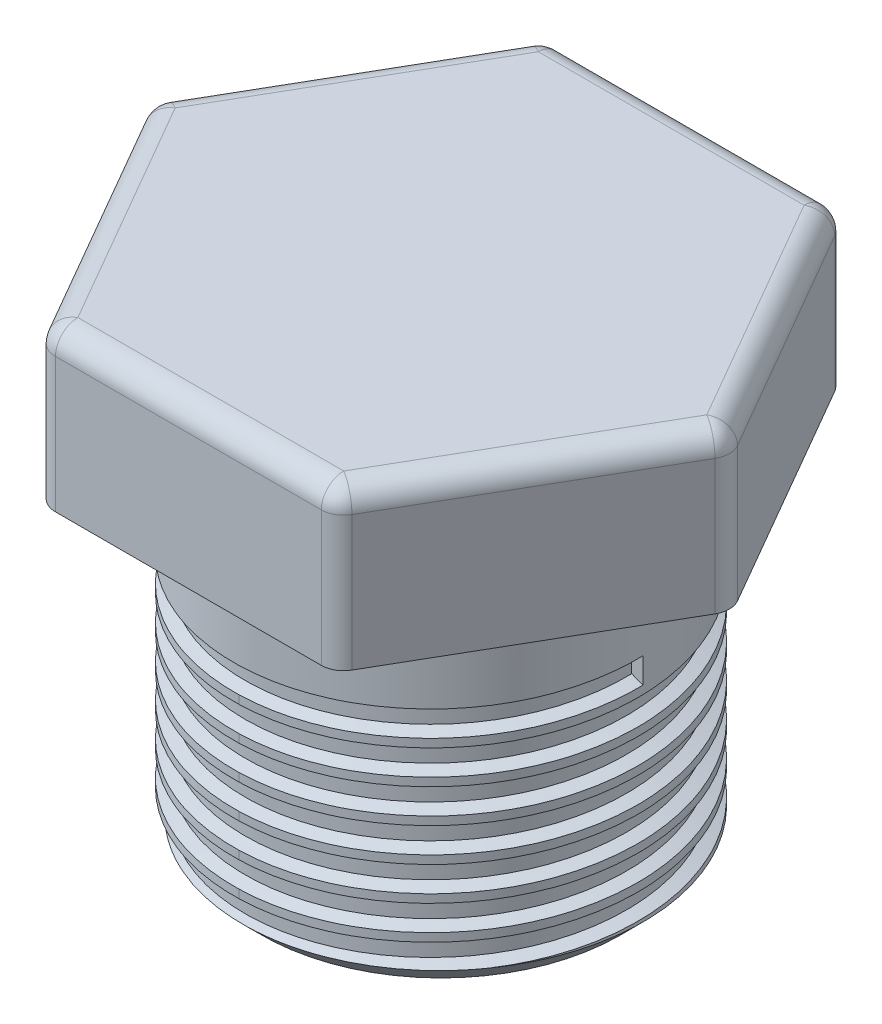
from build123d import *

# Parameters (mm, degrees)
EXTRUDE_1_DEPTH     = 7
SKETCH_2_R          = 9
EXTRUDE_2_DEPTH     = 15
CHAMFER_2_SIZE      = 1
FILLET_5_R          = 1
FILLET_6_R          = 1
FILLET_7_R          = 1
FILLET_8_R          = 1
FILLET_9_R          = 1
FILLET_10_R         = 1
SWEEP_1_PITCH       = 1.5
SWEEP_1_HEIGHT      = 10.5
SWEEP_1_RADIUS      = 9
SWEEP_1_START_ANGLE = 90
FILLET_13_R         = 1


with BuildPart() as part:
    # 草图1 → 凸台-拉伸1 (new body)
    with BuildSketch(Plane(origin=(0, 0, 0), x_dir=(1, 0, 0), z_dir=(0, 1, 0))):
        Polygon((-13, 0), (-6.5, -11.258330249), (6.5, -11.258330249), (13, 0), (6.5, 11.258330249), (-6.5, 11.258330249), align=None)
    extrude(amount=EXTRUDE_1_DEPTH)

    # 草图2 → 凸台-拉伸2 (add)
    with BuildSketch(Plane.XZ):
        with Locations(Location((0, 0, 0), (0, 0, 90))):
            Circle(SKETCH_2_R)
    extrude(amount=EXTRUDE_2_DEPTH)

    # 倒角2
    chamfer_2_edges = [part.edges().sort_by_distance(p)[0] for p in [
        (0, -15, -9),
    ]]
    chamfer(chamfer_2_edges, length=CHAMFER_2_SIZE)

    # 圆角5
    fillet_5_edges = [part.edges().sort_by_distance(p)[0] for p in [
        (6.5, 3.5, 11.258330249),
    ]]
    fillet(fillet_5_edges, radius=FILLET_5_R)

    # 圆角6
    fillet_6_edges = [part.edges().sort_by_distance(p)[0] for p in [
        (13, 3.5, 0),
    ]]
    fillet(fillet_6_edges, radius=FILLET_6_R)

    # 圆角7
    fillet_7_edges = [part.edges().sort_by_distance(p)[0] for p in [
        (6.5, 3.5, -11.258330249),
    ]]
    fillet(fillet_7_edges, radius=FILLET_7_R)

    # 圆角8
    fillet_8_edges = [part.edges().sort_by_distance(p)[0] for p in [
        (-6.5, 3.5, -11.258330249),
    ]]
    fillet(fillet_8_edges, radius=FILLET_8_R)

    # 圆角9
    fillet_9_edges = [part.edges().sort_by_distance(p)[0] for p in [
        (-13, 3.5, 0),
    ]]
    fillet(fillet_9_edges, radius=FILLET_9_R)

    # 圆角10
    fillet_10_edges = [part.edges().sort_by_distance(p)[0] for p in [
        (-6.5, 3.5, 11.258330249),
    ]]
    fillet(fillet_10_edges, radius=FILLET_10_R)

    # 切除-扫描1: sweep along a helix
    with BuildLine() as sweep_1_path:
        add(Helix(SWEEP_1_PITCH, SWEEP_1_HEIGHT, SWEEP_1_RADIUS, center=(0, -15, 0), direction=(0, 1, 0), mode=Mode.PRIVATE).rotate(Axis((0, -15, 0), (0, 1, 0)), SWEEP_1_START_ANGLE))
    # 草图10 → 切除-扫描1 (sweep, cut)
    with BuildSketch(Plane.XY):
        Polygon((8.5, -15.163642673), (8.5, -14.513642673), (9.177734192, -14.118973763), (9.177734192, -15.418973763), align=None)
    sweep(path=sweep_1_path.line, is_frenet=True, mode=Mode.SUBTRACT)

    # 圆角13
    fillet_13_edges = [part.edges().sort_by_distance(p)[0] for p in [
        (9.75, 7, 5.629165125),
        (6.422649731, 7, 11.124355653),
        (9.75, 7, -5.629165125),
        (12.845299462, 7, 0),
        (0, 7, -11.258330249),
        (6.422649731, 7, -11.124355653),
        (-9.75, 7, -5.629165125),
        (-6.422649731, 7, -11.124355653),
        (-9.75, 7, 5.629165125),
        (-12.845299462, 7, 0),
        (0, 7, 11.258330249),
        (-6.422649731, 7, 11.124355653),
    ]]
    fillet(fillet_13_edges, radius=FILLET_13_R)


solid = part.part
